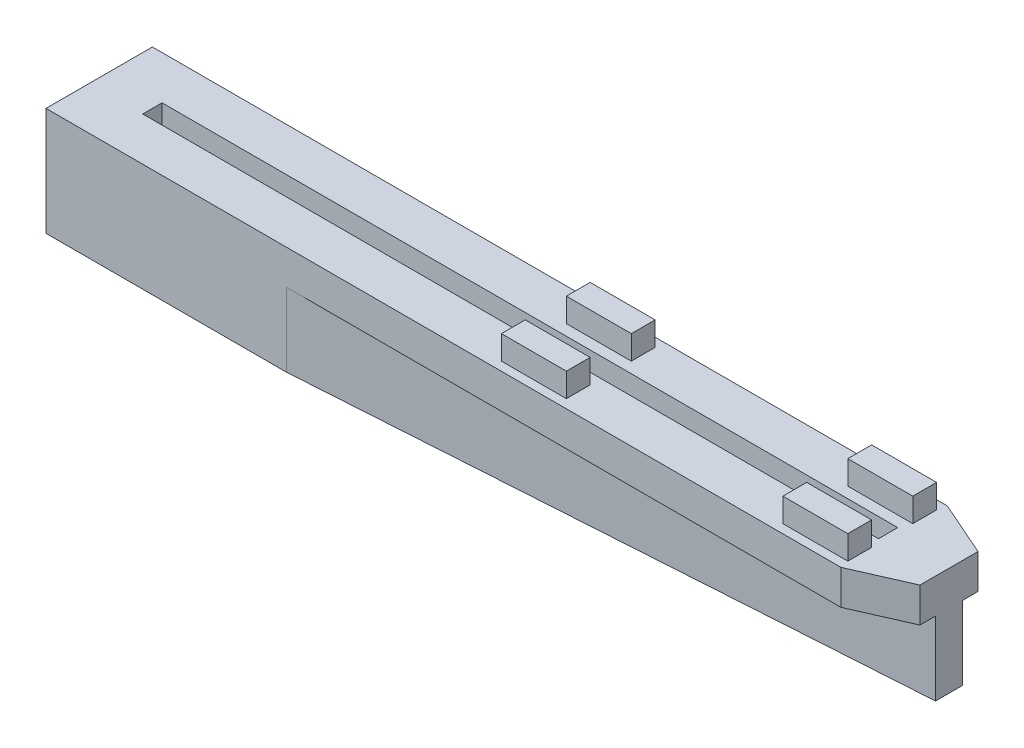
from build123d import *

# Parameters (mm, degrees)
BOSS_EXTRUDE1_DEPTH = 5
SKETCH2_W           = 169.901358226
SKETCH2_H           = 4.457880692
CUT_EXTRUDE1_DEPTH  = 26
SKETCH3_W           = 15
SKETCH3_H           = 5.5
BOSS_EXTRUDE2_DEPTH = 5.5
SKETCH4_W           = 169.901358226
SKETCH4_H           = 4.457880692
BOSS_EXTRUDE3_DEPTH = 20
CUT_EXTRUDE5_DEPTH  = 17


with BuildPart() as part:
    # Sketch1 → Boss-Extrude1 (new body)
    with BuildSketch(Plane(origin=(0, 0, 0), x_dir=(1, 0, 0), z_dir=(0, 1, 0))):
        Polygon((-43.153560924, 18.119952768), (140.433207055, 18.119952768), (153.094163244, 12.542432967), (153.094163244, -0.867190791), (140.433207055, -6.444710592), (-43.153560924, -6.444710592), align=None)
    extrude(amount=BOSS_EXTRUDE1_DEPTH)

    # Sketch2 → Cut-Extrude1 (cut)
    with BuildSketch(Plane.XZ):
        with Locations((54.091074894, -5.837621088)):
            Rectangle(SKETCH2_W, SKETCH2_H)
    extrude(amount=-CUT_EXTRUDE1_DEPTH, mode=Mode.SUBTRACT)

    # Sketch3 → Boss-Extrude2 (add)
    with BuildSketch(Plane(origin=(0, 5, 0), x_dir=(1, 0, 0), z_dir=(0, 1, 0))):
        with Locations((132.483358294, 13.337621088)):
            Rectangle(SKETCH3_W, SKETCH3_H)
        with Locations((132.483358294, -1.662378912)):
            Rectangle(SKETCH3_W, SKETCH3_H)
        with Locations((67.483358294, -1.662378912)):
            Rectangle(SKETCH3_W, SKETCH3_H)
        with Locations((67.483358294, 13.337621088)):
            Rectangle(SKETCH3_W, SKETCH3_H)
    extrude(amount=BOSS_EXTRUDE2_DEPTH)

    # Sketch4 → Boss-Extrude3 (add)
    with BuildSketch(Plane.XZ):
        Polygon((-43.153560924, 6.444710592), (-43.153560924, -18.119952768), (140.433207055, -18.119952768), (153.094163244, -12.542432967), (153.094163244, 0.867190791), (140.433207055, 6.444710592), align=None)
        with Locations((54.091074894, -5.837621088)):
            Rectangle(SKETCH4_W, SKETCH4_H, mode=Mode.SUBTRACT)
    extrude(amount=BOSS_EXTRUDE3_DEPTH)

    # Sketch7 → Cut-Extrude5 (cut)
    with BuildSketch(Plane.XZ.offset(20)):
        Polygon((12.387057353, -18.119952768), (140.433207055, -18.119952768), (153.094163244, -12.542432967), (153.094163244, -8.937621088), align=None)
        Polygon((153.094163244, -2.737621088), (153.094163244, 0.867190791), (140.433207055, 6.444710592), (12.387057353, 6.444710592), align=None)
    extrude(amount=-CUT_EXTRUDE5_DEPTH, mode=Mode.SUBTRACT)


solid = part.part
